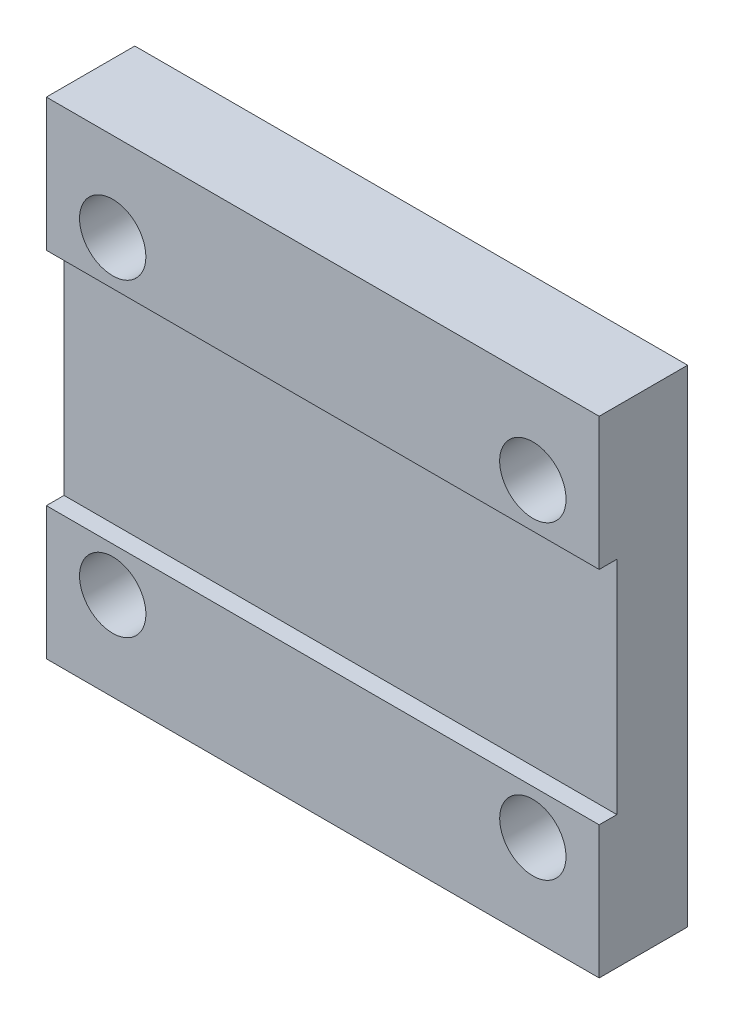
from build123d import *

# Parameters (mm, degrees)
SKETCH_1_W          = 25
SKETCH_1_H          = 22
SKETCH_1_R          = 1.5
EXTRUDE_1_DEPTH     = 4
SKETCH_2_W          = 25
SKETCH_2_H          = 10
CUT_EXTRUDE_1_DEPTH = 0.8


with BuildPart() as part:
    # 草图1 → 凸台-拉伸1 (new body)
    with BuildSketch(Plane.XY):
        Rectangle(SKETCH_1_W, SKETCH_1_H)
        with Locations((-9.5, 7)):
            Circle(SKETCH_1_R, mode=Mode.SUBTRACT)
        with Locations((9.5, 7)):
            Circle(SKETCH_1_R, mode=Mode.SUBTRACT)
        with Locations(Location((9.5, -7, 0), (0, 0, 180))):
            Circle(SKETCH_1_R, mode=Mode.SUBTRACT)
        with Locations(Location((-9.5, -7, 0), (0, 0, 180))):
            Circle(SKETCH_1_R, mode=Mode.SUBTRACT)
    extrude(amount=EXTRUDE_1_DEPTH)

    # 草图2 → 切除-拉伸1 (cut)
    with BuildSketch(Plane.XY.offset(4)):
        Rectangle(SKETCH_2_W, SKETCH_2_H)
    extrude(amount=-CUT_EXTRUDE_1_DEPTH, mode=Mode.SUBTRACT)


solid = part.part
